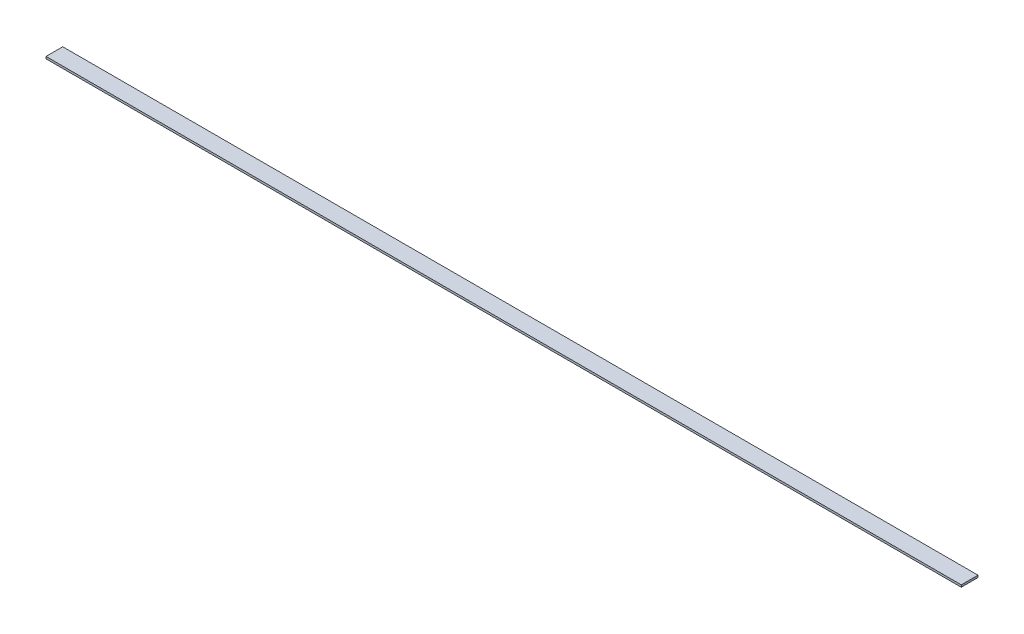
from build123d import *

# Parameters (mm, degrees)
SKETCH1_W           = 1093
SKETCH1_H           = 20
BOSS_EXTRUDE1_DEPTH = 2.5


with BuildPart() as part:
    # Sketch1 → Boss-Extrude1 (new body)
    with BuildSketch(Plane(origin=(0, 0, 0), x_dir=(1, 0, 0), z_dir=(0, 1, 0))):
        Rectangle(SKETCH1_W, SKETCH1_H)
    extrude(amount=BOSS_EXTRUDE1_DEPTH)


solid = part.part
